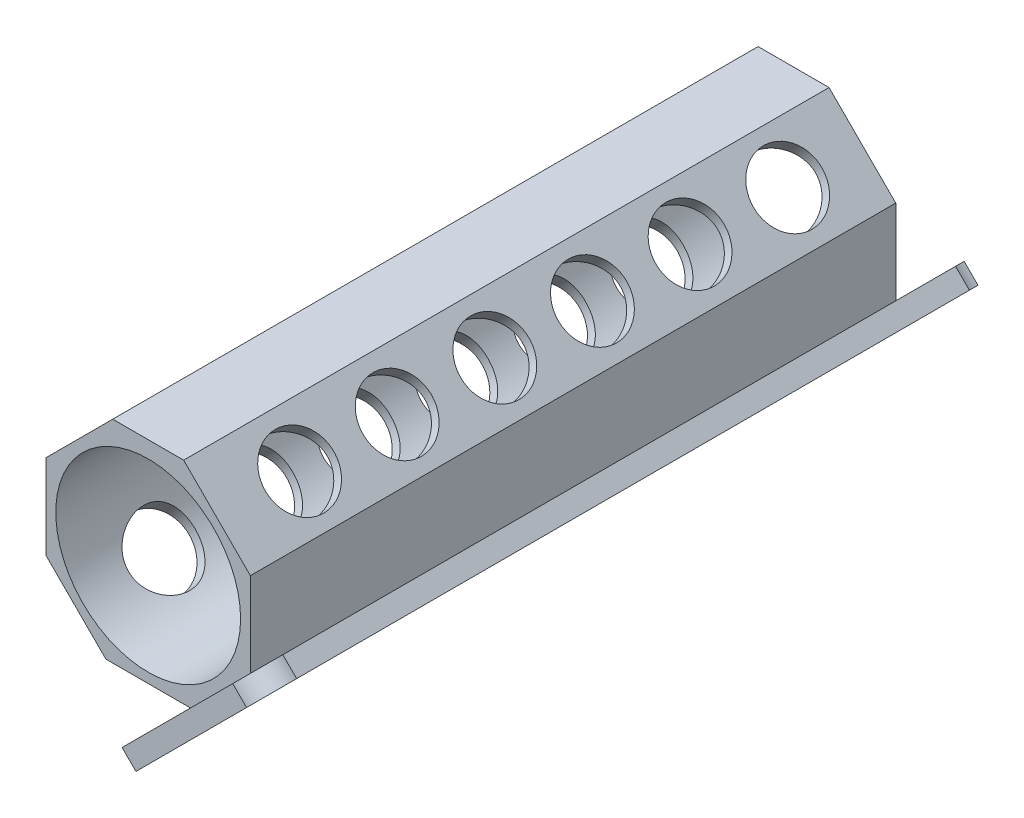
from build123d import *

# Parameters (mm, degrees)
SKIZZE1_R                        = 9.45
AUFSATZ_LINEAR_AUSTRAGEN1_DEPTH  = 66
SKIZZE9_R                        = 3.5
SCHNITT_LINEAR_AUSTRAGEN8_DEPTH  = 71.657475281
SKIZZE13_W                       = 22
SKIZZE13_H                       = 74.8
AUFSATZ_LINEAR_AUSTRAGEN2_DEPTH  = 2
SKIZZE14_R                       = 3
SCHNITT_LINEAR_AUSTRAGEN12_DEPTH = 2


with BuildPart() as part:
    # Skizze1 → Aufsatz-Linear austragen1 (new body)
    with BuildSketch(Plane(origin=(0, 0, 0), x_dir=(0, 1, 0), z_dir=(0, 0, 1))):
        Polygon((11.150811659, 3.627720068), (11.150811659, -3.627720068), (4.328531727, -10.45), (-4.328531727, -10.45), (-10.45, -4.328531727), (-10.45, 4.328531727), (-4.328531727, 10.45), (4.328531727, 10.45), align=None)
        with Locations(Location((0, 0, 0), (0, 0, 270))):
            Circle(SKIZZE1_R, mode=Mode.SUBTRACT)
    extrude(amount=AUFSATZ_LINEAR_AUSTRAGEN1_DEPTH)

    # Skizze9 → Schnitt-Linear austragen8 (cut, through all)
    with BuildSketch(Plane(origin=(7.389265863, 7.389265863, 0), x_dir=(-0.7071067811865476, 0.7071067811865475, 0), z_dir=(0.7071067811865475, 0.7071067811865476, 0))):
        with Locations((0.432478845, 57.6)):
            Circle(SKIZZE9_R)
        with Locations((0.456584688, 47.600029055)):
            Circle(SKIZZE9_R)
        with Locations((0.480690531, 37.600058109)):
            Circle(SKIZZE9_R)
        with Locations((0.504796374, 27.600087164)):
            Circle(SKIZZE9_R)
        with Locations((0.528902217, 17.600116219)):
            Circle(SKIZZE9_R)
        with Locations((0.553008059, 7.600145273)):
            Circle(SKIZZE9_R)
    extrude(amount=-SCHNITT_LINEAR_AUSTRAGEN8_DEPTH, mode=Mode.SUBTRACT)

    # Skizze13 → Aufsatz-Linear austragen2 (add)
    with BuildSketch(Plane(origin=(7.389265863, -7.389265863, 0), x_dir=(0.7071067811865477, 0.7071067811865475, 0), z_dir=(0.7071067811865475, -0.7071067811865477, 0))):
        with Locations((0, 33)):
            Rectangle(SKIZZE13_W, SKIZZE13_H)
    extrude(amount=AUFSATZ_LINEAR_AUSTRAGEN2_DEPTH)

    # Skizze14 → Schnitt-Linear austragen12 (cut)
    with BuildSketch(Plane(origin=(8.803479426, -8.803479426, 0), x_dir=(0.7071067811865478, 0.7071067811865474, 0), z_dir=(0.7071067811865474, -0.7071067811865478, 0))):
        with Locations((11, 70.4)):
            Circle(SKIZZE14_R)
        with Locations((-11, 70.4)):
            Circle(SKIZZE14_R)
        with Locations((-11, -4.4)):
            Circle(SKIZZE14_R)
        with Locations((11, -4.4)):
            Circle(SKIZZE14_R)
    extrude(amount=-SCHNITT_LINEAR_AUSTRAGEN12_DEPTH, mode=Mode.SUBTRACT)


solid = part.part
